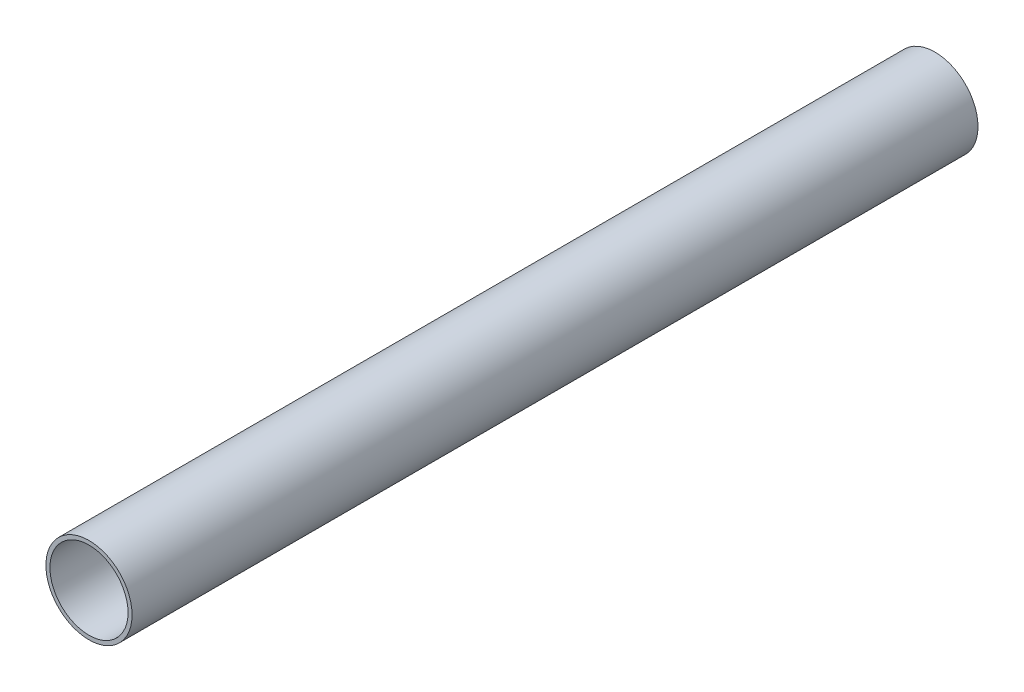
from build123d import *

# Parameters (mm, degrees)
CROQUIS1_R              = 14
CROQUIS1_R_2            = 12.7
SALIENTE_EXTRUIR1_DEPTH = 275


with BuildPart() as part:
    # Croquis1 → Saliente-Extruir1 (new body)
    with BuildSketch(Plane.XY):
        Circle(CROQUIS1_R)
        Circle(CROQUIS1_R_2, mode=Mode.SUBTRACT)
    extrude(amount=SALIENTE_EXTRUIR1_DEPTH)


solid = part.part
